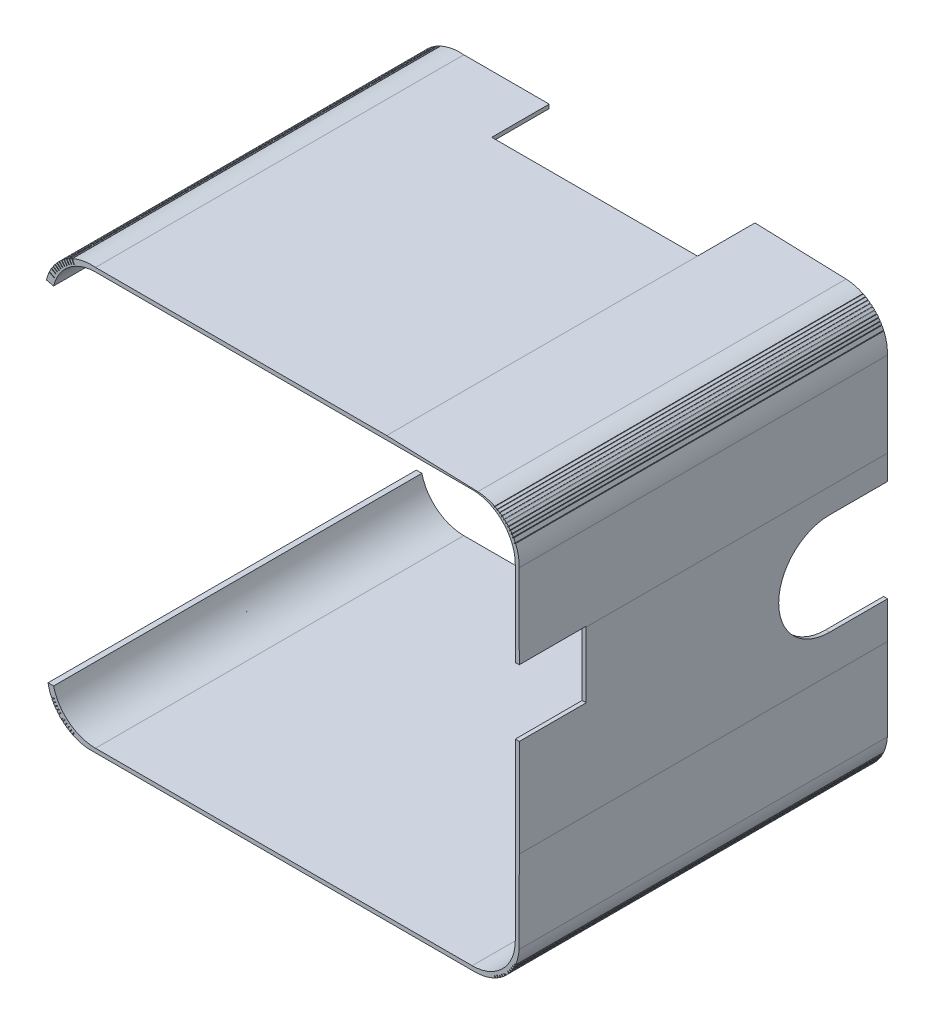
from build123d import *

# Parameters (mm, degrees)
BOSS_EXTRUDE1_DEPTH = 256.2
SKETCH3_W           = 143.047102468
SKETCH3_H           = 40
CUT_EXTRUDE2_DEPTH  = 10
CUT_EXTRUDE3_DEPTH  = 10
SKETCH5_W           = 46.554660904
SKETCH5_H           = 46.154670947
CUT_EXTRUDE4_DEPTH  = 10
CUT_EXTRUDE5_DEPTH  = 436.486084738


with BuildPart() as part:
    # Sketch1 → Boss-Extrude1 (new body)
    with BuildSketch(Plane.XY):
        with BuildLine():
            Line((-55.162966975, -201.737141267), (-59.025658327, -201.737141267))
            ThreePointArc((-59.025658327, -201.737141267), (-49.64481988, -219.188683944), (-31.659311904, -227.5))
            Line((-31.659311904, -227.5), (238.345910115, -227.5))
            ThreePointArc((238.345910115, -227.5), (259.201443481, -218.996066739), (268.690230442, -198.569782817))
            Line((268.690230442, -198.569782817), (268.8, -141.044791416))
            Line((268.8, -141.044791416), (268.8, -27.561644953))
            Line((268.8, -27.561644953), (268.648605897, 31.291767209))
            ThreePointArc((268.648605897, 31.291767209), (260.89818947, 53.07596459), (239.952411289, 62.868542733))
            Line((239.952411289, 62.868542733), (176.563974327, 65))
            Line((176.563974327, 65), (33.436025673, 65))
            Line((33.436025673, 65), (-26, 65))
            ThreePointArc((-26, 65), (-47.648522566, 58.996989731), (-60.146644754, 40.329059923))
            Line((-60.146644754, 40.329059923), (-55.179132045, 39.169810119))
            ThreePointArc((-55.179132045, 39.169810119), (-44.586361887, 55.748824849), (-26, 62.2))
            Line((-26, 62.2), (236, 62.2))
            ThreePointArc((236, 62.2), (257.213203436, 53.413203436), (266, 32.2))
            Line((266, 32.2), (266, -194.7))
            ThreePointArc((266, -194.7), (257.213203436, -215.913203436), (236, -224.7))
            Line((236, -224.7), (-26, -224.7))
            ThreePointArc((-26, -224.7), (-44.559172422, -218.270259205), (-55.162966975, -201.737141267))
        make_face()
    extrude(amount=-BOSS_EXTRUDE1_DEPTH)

    # Sketch3 → Cut-Extrude2 (cut)
    with BuildSketch(Plane(origin=(2.382587057, 70.856907056, 0), x_dir=(0.9994351474565969, -0.033606339110507484, 0), z_dir=(0.033606339110507484, 0.9994351474565969, 0))):
        with Locations((102.756278441, 236.2)):
            Rectangle(SKETCH3_W, SKETCH3_H)
    extrude(amount=-CUT_EXTRUDE2_DEPTH, mode=Mode.SUBTRACT)

    # Sketch4 → Cut-Extrude3 (cut)
    with BuildSketch(Plane(origin=(268.8, 0, 0), x_dir=(0, 0, -1), z_dir=(1, 0, 0))):
        with BuildLine():
            Line((215.80354819, -115.33744579), (256.2, -115.33744579))
            Line((256.2, -115.33744579), (256.2, -44.66255421))
            Line((256.2, -44.66255421), (215.80354819, -44.66255421))
            ThreePointArc((215.80354819, -44.66255421), (180.4661024, -80), (215.80354819, -115.33744579))
        make_face()
    extrude(amount=-CUT_EXTRUDE3_DEPTH, mode=Mode.SUBTRACT)

    # Sketch5 → Cut-Extrude4 (cut)
    with BuildSketch(Plane(origin=(268.8, 0, 0), x_dir=(0, 0, -1), z_dir=(1, 0, 0))):
        with Locations((23.277330452, -50.096092803)):
            Rectangle(SKETCH5_W, SKETCH5_H)
    extrude(amount=-CUT_EXTRUDE4_DEPTH, mode=Mode.SUBTRACT)

    # Sketch2 → Cut-Extrude5 (cut, through all)
    with BuildSketch(Plane(origin=(0, 0, -256.2), x_dir=(-1, 0, 0), z_dir=(0, 0, -1))):
        Polygon((-259.690523626, -218.098149237), (-259.545393882, -217.9530469), (-259.253074507, -218.245421489), (-259.397251059, -218.391410686), (-262.623372302, -221.65809202), (-262.939186735, -221.346198834), align=None)
        Polygon((-262.768866829, -216.982242273), (-261.012249986, -215.433870998), (-260.85829557, -215.29816776), (-260.584911374, -215.6083203), (-260.737970163, -215.7449685), (-262.482771178, -217.302696213), align=None)
        Polygon((-264.089799027, -215.324507327), (-262.239425429, -213.889490294), (-262.077253931, -213.763721712), (-261.823883835, -214.090428173), (-261.985220809, -214.217196088), (-263.82438939, -215.662293019), align=None)
        Polygon((-265.304034629, -213.587101524), (-263.367206855, -212.271102088), (-263.19745829, -212.155764515), (-262.965102231, -212.497735535), (-263.134080666, -212.61412287), (-265.060358456, -213.940885881), align=None)
        Polygon((-266.4067816, -211.776881609), (-264.391143425, -210.58509342), (-264.214487715, -210.48064204), (-264.004062695, -210.836528016), (-264.180015711, -210.942075444), (-266.18580057, -212.145268408), align=None)
        Polygon((-269.815625515, -211.145402394), (-269.615967315, -211.543380251), (-265.328047641, -209.358065976), (-265.145199561, -209.264878475), (-265.332932665, -208.896517513), (-265.516329646, -208.988524418), align=None)
        Polygon((-269.615967315, 46.919268294), (-265.328047641, 44.733954019), (-265.145199561, 44.640766518), (-265.332932665, 44.272405555), (-265.516329646, 44.364412461), (-269.815625515, 46.521290437), align=None)
        Polygon((-260.210075765, 57.701685238), (-260.539220938, 57.415139009), (-258.279462601, 54.852434214), (-258.143730288, 54.698505432), (-257.833629386, 54.971948201), (-257.9683547, 55.126702242), align=None)
        Polygon((-258.782691717, 59.431058867), (-259.131251484, 59.164158921), (-256.784635722, 56.139509943), (-256.658836514, 55.977362201), (-256.332177912, 56.230793997), (-256.45692029, 56.393702139), align=None)
        Polygon((-256.903786621, 60.59813225), (-257.26751331, 60.354251397), (-255.211942389, 57.330184965), (-255.096572758, 57.160458187), (-254.754645628, 57.39287883), (-254.868912769, 57.563298149), align=None)
        Polygon((-254.84547543, 61.435133315), (-255.221563365, 61.215874959), (-253.567589303, 58.419760231), (-253.463104561, 58.243124251), (-253.107258333, 58.453616483), (-253.210599276, 58.630874411), align=None)
        Polygon((-253.107247352, 62.818811358), (-253.498422809, 62.622565798), (-251.858065976, 59.403935684), (-251.764878475, 59.221087604), (-251.396517513, 59.408820708), (-251.488524418, 59.592217689), align=None)
        Polygon((-267.731473461, 49.648345994), (-267.958334142, 49.270157513), (-264.391143425, 47.160981463), (-264.214487715, 47.056530083), (-264.004062695, 47.412416059), (-264.180015711, 47.517963486), align=None)
        Polygon((-267.225143802, 52.007813867), (-267.478275209, 51.640301806), (-263.367206855, 48.846990131), (-263.19745829, 48.731652558), (-262.965102231, 49.073623578), (-263.134080666, 49.190010913), align=None)
        Polygon((-265.280336961, 53.382168289), (-265.553001044, 53.035149897), (-262.239425429, 50.465378336), (-262.077253931, 50.339609755), (-261.823883835, 50.666316216), (-261.985220809, 50.793084131), align=None)
        Polygon((-264.030672622, 55.260523488), (-264.32553166, 54.930253734), (-261.012249986, 52.009759041), (-260.85829557, 51.874055802), (-260.584911374, 52.184208343), (-260.737970163, 52.320856542), align=None)
        Polygon((-262.939186735, 56.722086876), (-259.690523626, 53.474037279), (-259.545393882, 53.328934942), (-259.253074507, 53.621309532), (-259.397251059, 53.767298728), (-262.623372302, 57.033980063), align=None)
        Polygon((58.966287957, -211.543380251), (54.678368284, -209.358065976), (54.495520203, -209.264878475), (54.683253307, -208.896517513), (54.866650289, -208.988524418), (59.165946157, -211.145402394), align=None)
        Polygon((48.854483029, -220.314940317), (49.178486259, -220.032870546), (47.629783243, -218.276546172), (47.49405093, -218.122617389), (47.183950029, -218.396060159), (47.318675343, -218.550814199), align=None)
        Polygon((47.229247658, -221.674893277), (47.570322849, -221.413724436), (46.134956364, -219.5636219), (46.009157156, -219.401474159), (45.682498554, -219.654905955), (45.807240932, -219.817814096), align=None)
        Polygon((45.521827164, -222.930113306), (45.878628249, -222.690876111), (44.562263031, -220.754296922), (44.4468934, -220.584570145), (44.10496627, -220.816990788), (44.219233411, -220.987410106), align=None)
        Polygon((43.738959957, -224.075646625), (44.110078804, -223.859285236), (42.917909946, -221.843872188), (42.813425203, -221.667236208), (42.457578975, -221.87772844), (42.560919918, -222.054986368), align=None)
        Polygon((41.887682199, -225.106972339), (42.271654172, -224.914340634), (41.208386619, -222.828047641), (41.115199117, -222.645199561), (40.746838155, -222.832932665), (40.83884506, -223.016329646), align=None)
        Polygon((55.536121212, -212.145268408), (55.757102242, -211.776881609), (53.741464067, -210.58509342), (53.564808357, -210.48064204), (53.354383337, -210.836528016), (53.530336353, -210.942075444), align=None)
        Polygon((54.410679098, -213.940885881), (54.654355271, -213.587101524), (52.717527497, -212.271102088), (52.547778932, -212.155764515), (52.315422873, -212.497735535), (52.484401308, -212.61412287), align=None)
        Polygon((53.174710032, -215.662293019), (53.440119669, -215.324507327), (51.589746071, -213.889490294), (51.427574573, -213.763721712), (51.174204477, -214.090428173), (51.335541451, -214.217196088), align=None)
        Polygon((51.833091821, -217.302696213), (52.119187472, -216.982242273), (50.362570628, -215.433870998), (50.208616213, -215.29816776), (49.935232016, -215.6083203), (50.088290805, -215.7449685), align=None)
        Polygon((52.289507377, -221.346198834), (49.040844268, -218.098149237), (48.895714524, -217.9530469), (48.60339515, -218.245421489), (48.747571701, -218.391410686), (51.973692945, -221.65809202), align=None)
        Polygon((49.040844268, 53.474037279), (48.895714524, 53.328934942), (48.60339515, 53.621309532), (48.747571701, 53.767298728), (51.973692945, 57.033980063), (52.289507377, 56.722086876), align=None)
        Polygon((53.675852302, 54.930253734), (50.362570628, 52.009759041), (50.208616213, 51.874055802), (49.935232016, 52.184208343), (50.088290805, 52.320856542), (53.380993264, 55.260523488), align=None)
        Polygon((54.903321686, 53.035149897), (51.589746071, 50.465378336), (51.427574573, 50.339609755), (51.174204477, 50.666316216), (51.335541451, 50.793084131), (54.630657603, 53.382168289), align=None)
        Polygon((56.828595851, 51.640301806), (52.717527497, 48.846990131), (52.547778932, 48.731652558), (52.315422873, 49.073623578), (52.484401308, 49.190010913), (56.575464444, 52.007813867), align=None)
        Polygon((57.308654785, 49.270157513), (53.741464067, 47.160981463), (53.564808357, 47.056530083), (53.354383337, 47.412416059), (53.530336353, 47.517963486), (57.081794103, 49.648345994), align=None)
        Polygon((42.848743451, 62.622565798), (41.208386619, 59.403935684), (41.115199117, 59.221087604), (40.746838155, 59.408820708), (40.83884506, 59.592217689), (42.457567994, 62.818811358), align=None)
        Polygon((44.571884007, 61.215874959), (42.917909946, 58.419760231), (42.813425203, 58.243124251), (42.457578975, 58.453616483), (42.560919918, 58.630874411), (44.195796072, 61.435133315), align=None)
        Polygon((46.617833952, 60.354251397), (44.562263031, 57.330184965), (44.4468934, 57.160458187), (44.10496627, 57.39287883), (44.219233411, 57.563298149), (46.254107263, 60.59813225), align=None)
        Polygon((48.481572126, 59.164158921), (46.134956364, 56.139509943), (46.009157156, 55.977362201), (45.682498554, 56.230793997), (45.807240932, 56.393702139), (48.133012359, 59.431058867), align=None)
        Polygon((49.88954158, 57.415139009), (47.629783243, 54.852434214), (47.49405093, 54.698505432), (47.183950029, 54.971948201), (47.318675343, 55.126702242), (49.560396407, 57.701685238), align=None)
        Polygon((59.165946157, 46.521290437), (58.966287957, 46.919268294), (54.678368284, 44.733954019), (54.495520203, 44.640766518), (54.683253307, 44.272405555), (54.866650289, 44.364412461), align=None)
        Polygon((-252.92133353, -224.914340634), (-251.858065976, -222.828047641), (-251.764878475, -222.645199561), (-251.396517513, -222.832932665), (-251.488524418, -223.016329646), (-252.537361557, -225.106972339), align=None)
        Polygon((-254.759758162, -223.859285236), (-253.567589303, -221.843872188), (-253.463104561, -221.667236208), (-253.107258333, -221.87772844), (-253.210599276, -222.054986368), (-254.388639315, -224.075646625), align=None)
        Polygon((-256.528307607, -222.690876111), (-255.211942389, -220.754296922), (-255.096572758, -220.584570145), (-254.754645628, -220.816990788), (-254.868912769, -220.987410106), (-256.171506522, -222.930113306), align=None)
        Polygon((-258.220002207, -221.413724436), (-256.784635722, -219.5636219), (-256.658836514, -219.401474159), (-256.332177912, -219.654905955), (-256.45692029, -219.817814096), (-257.878927016, -221.674893277), align=None)
        Polygon((-259.828165617, -220.032870546), (-258.279462601, -218.276546172), (-258.143730288, -218.122617389), (-257.833629386, -218.396060159), (-257.9683547, -218.550814199), (-259.504162387, -220.314940317), align=None)
    extrude(amount=-CUT_EXTRUDE5_DEPTH, mode=Mode.SUBTRACT)


solid = part.part
